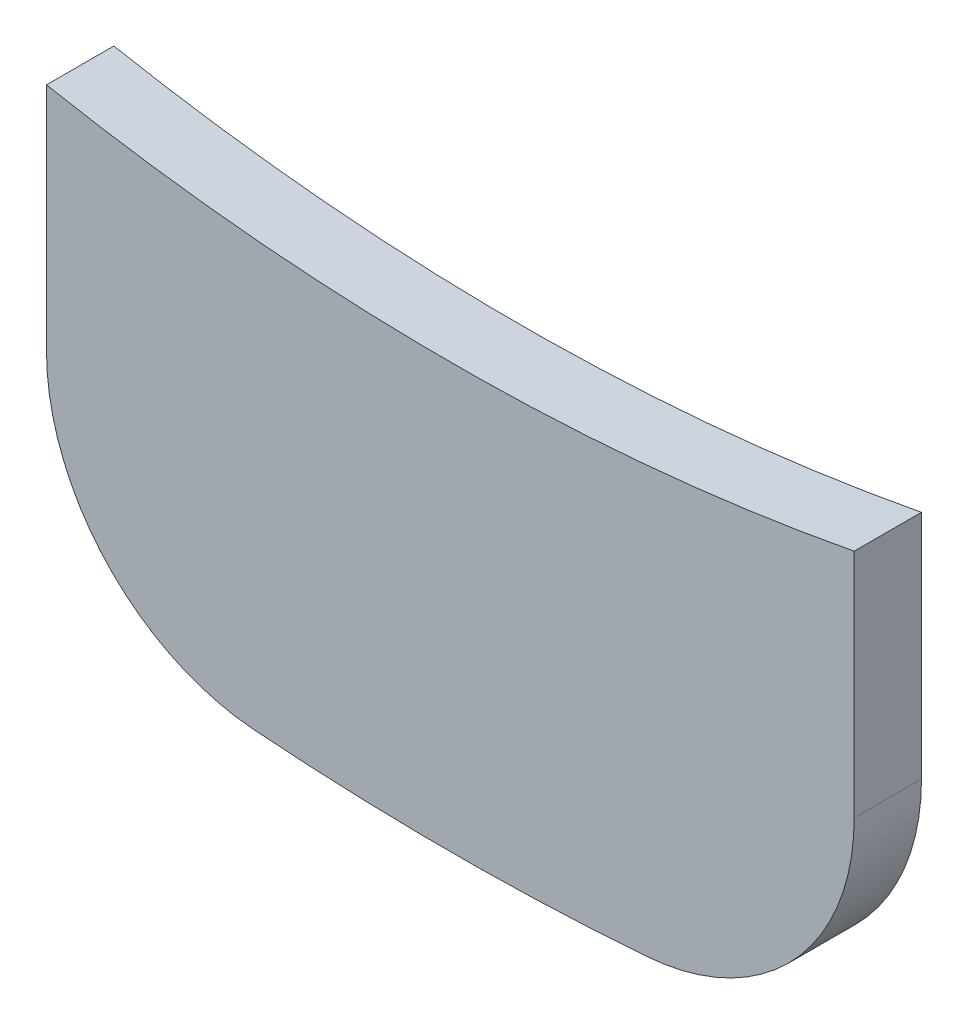
from build123d import *

# Parameters (mm, degrees)
BOSS_EXTRUDE1_DEPTH = 3


with BuildPart() as part:
    # Sketch2 → Boss-Extrude1 (new body)
    with BuildSketch(Plane.XY):
        with BuildLine():
            Line((18, -104.694794522), (18, -94.399205505))
            ThreePointArc((18, -94.399205505), (0, -96.1), (-18, -94.399205505))
            Line((-18, -94.399205505), (-18, -104.694794522))
            ThreePointArc((-18, -104.694794522), (-15.335497516, -111.49115209), (-8.761904762, -114.665727334))
            ThreePointArc((-8.761904762, -114.665727334), (0, -115), (8.761904762, -114.665727334))
            ThreePointArc((8.761904762, -114.665727334), (13.812374448, -112.832134584), (17.184851944, -108.649348197))
            ThreePointArc((17.184851944, -108.649348197), (17.794093103, -106.713640797), (18, -104.694794522))
        make_face()
    extrude(amount=BOSS_EXTRUDE1_DEPTH)


solid = part.part
